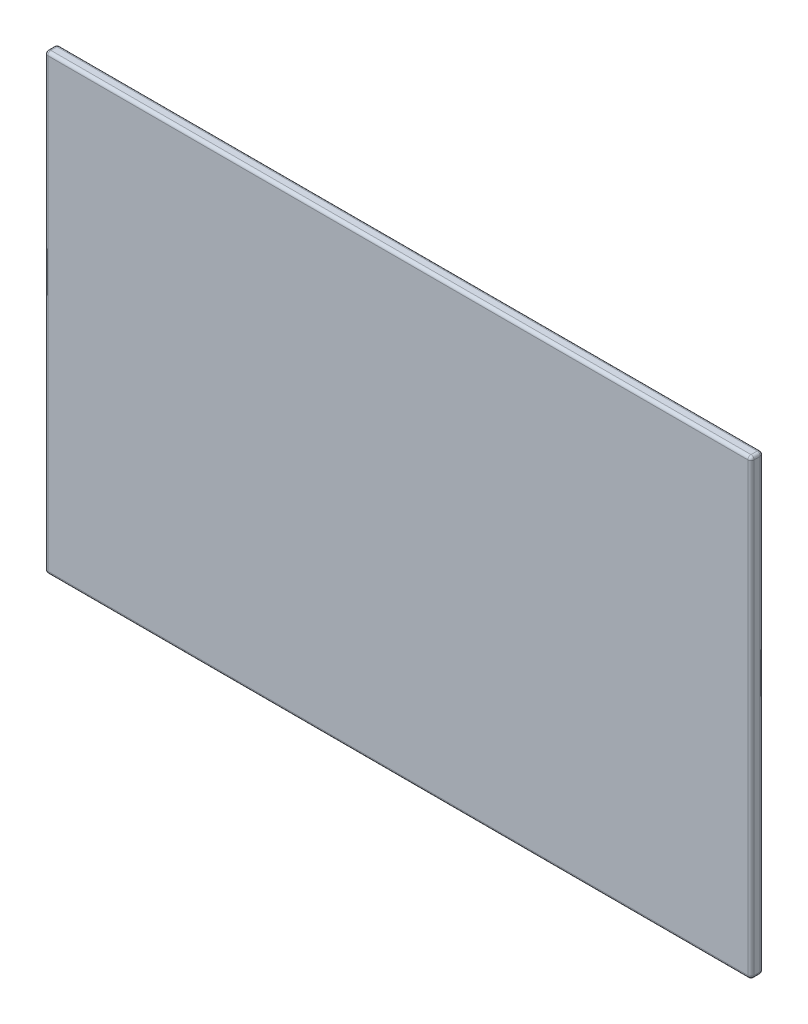
from build123d import *

# Parameters (mm, degrees)
SKETCH1_W           = 114.7
SKETCH1_H           = 73.5
BOSS_EXTRUDE1_DEPTH = 2
FILLET1_R           = 0.5


with BuildPart() as part:
    # Sketch1 → Boss-Extrude1 (new body)
    with BuildSketch(Plane.XY):
        Rectangle(SKETCH1_W, SKETCH1_H)
    extrude(amount=BOSS_EXTRUDE1_DEPTH)

    # Fillet1
    fillet1_edges = [part.edges().sort_by_distance(p)[0] for p in [
        (-57.35, 0, 2),
        (0, -36.75, 2),
        (57.35, 0, 2),
        (0, -36.75, 0),
        (-57.35, 0, 0),
        (0, 36.75, 0),
        (57.35, 0, 0),
        (57.35, -36.75, 1),
        (-57.35, -36.75, 1),
        (-57.35, 36.75, 1),
        (57.35, 36.75, 1),
        (0, 36.75, 2),
    ]]
    fillet(fillet1_edges, radius=FILLET1_R)


solid = part.part
